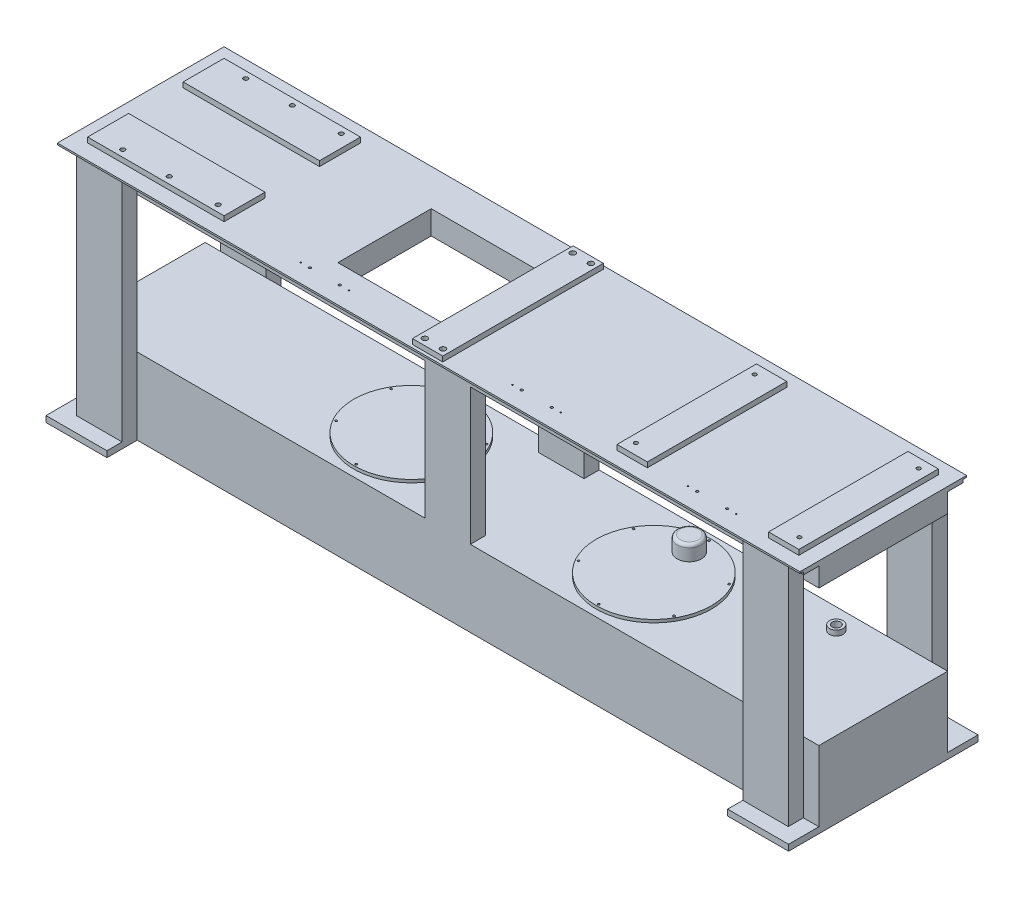
from build123d import *

# Parameters (mm, degrees)
SKETCH1_W                                 = 2450
SKETCH1_H                                 = 780
CORPO_DEPTH                               = 625
SKETCH3_W                                 = 2450
SKETCH3_H                                 = 754.4
CORTE_DOS_P_S_DEPTH                       = 50
SKETCH4_W                                 = 100
SKETCH4_H                                 = 745
CORTE_LATERAL_DEPTH                       = 51
ESPELHAMENTO_CORTE_LATERAL_2_COPY_1_SK_W  = 100
ESPELHAMENTO_CORTE_LATERAL_2_COPY_1_SK_H  = 745
ESPELHAMENTO_CORTE_LATERAL_2_COPY_1_DEPTH = 51
SKETCH5_W                                 = 425
SKETCH5_H                                 = 450
CORTE_INTERNO_DEPTH                       = 2559.36373489
SKETCH6_W                                 = 1024
SKETCH6_H                                 = 754.4
CORTE_DAS_PERNAS_DEPTH                    = 50
SKETCH7_W                                 = 150
SKETCH7_H                                 = 450
COLUNA_CENTRAL_DEPTH                      = 50
SKETCH8_W                                 = 100
SKETCH8_H                                 = 460
SKETCH8_H_2                               = 530
SKETCH8_W_2                               = 450
SKETCH8_H_3                               = 135
RESALTOS_DA_MESA_DEPTH                    = 17
RASGO_347X308_REACH                       = 1583.028
SKETCH9_W                                 = 347
SKETCH9_H                                 = 308
AJUSTE_TAMANHO_DA_MESA_REACH              = 1583.028
SKETCH16_W                                = 2450
SKETCH16_H                                = 37.5
SKETCH18_W                                = 2048
SKETCH18_H                                = 9.4
REBAIXO_DA_MESA_LADO_1_DEPTH              = 50
SKETCH38_W                                = 2048
SKETCH38_H                                = 9.4
REBAIXO_DA_MESA_LADO_2_DEPTH              = 50
SKETCH11_R                                = 4
FUROS_DOS_PINOS_8_DEPTH                   = 30
FUROS_DOS_CONTRAPONTOS_M5_D               = 4.2
FUROS_DOS_CONTRAPONTOS_M5_DEPTH           = 15
SKETCH17_W                                = 2048
SKETCH17_H                                = 100
CORTE_DO_CH_O_DEPTH                       = 1580.550252445
FUROS_PASSANTES_CENTRAIS_REACH            = 1591.484
SKETCH19_R                                = 8.9
FUROS_DA_MESA_M14_D                       = 12.5
FUROS_DA_MESA_M14_DEPTH                   = 95
FUROS_DA_MESA_M16_D                       = 14.5
FUROS_DA_MESA_M16_DEPTH                   = 95
SKETCH26_R                                = 22.5
ENCAIXE_DO_CANO_DA_BASE_DEPTH             = 17
FURO_DO_CANO_DA_BASE_M30_D                = 28
FURO_DO_CANO_DA_BASE_M30_DEPTH            = 30
FURO_DO_CANO_DA_BASE_M30_TIP              = 8.412048666
SKETCH29_R                                = 190
RESSALTOS_DA_BASE_DEPTH                   = 10
FUROS_DOS_RESSALTOS_M8_D                  = 7
FUROS_DOS_RESSALTOS_M8_DEPTH              = 30
FUROS_DOS_RESSALTOS_M8_TIP                = 2.103012167
SKETCH37_R                                = 40
TAMPA_DO_RESSALTO_DEPTH                   = 50
ARREDONDAMENTO_DA_TAMPA_R                 = 10


with BuildPart() as part:
    # Sketch1 → Corpo (new body)
    with BuildSketch(Plane.XY):
        Rectangle(SKETCH1_W, SKETCH1_H)
    extrude(amount=-CORPO_DEPTH)

    # Sketch3 → Corte dos Pés (cut)
    with BuildSketch(Plane.XY):
        with Locations((0, 7.2)):
            Rectangle(SKETCH3_W, SKETCH3_H)
    corte_dos_p_s = extrude(amount=-CORTE_DOS_P_S_DEPTH, mode=Mode.SUBTRACT)

    # Espelhamento - Corte dos Pés: Corte dos Pés across plane
    add(corte_dos_p_s.mirror(Plane.XY.offset(-312.5)), mode=Mode.SUBTRACT)

    # Sketch4 → Corte Lateral (cut)
    with BuildSketch(Plane(origin=(1225, 0, 0), x_dir=(0, 0, -1), z_dir=(1, 0, 0))):
        with Locations((50, 2.5)):
            Rectangle(SKETCH4_W, SKETCH4_H)
    corte_lateral = extrude(amount=-CORTE_LATERAL_DEPTH, mode=Mode.SUBTRACT)

    # Espelhamento - Corte Lateral 1: Corte Lateral across plane
    add(corte_lateral.mirror(Plane.XY.offset(-312.5)), mode=Mode.SUBTRACT)

    # Espelhamento - Corte Lateral 2: Corte Lateral across plane
    add(corte_lateral.mirror(Plane(origin=(0, 0, 0), x_dir=(0, 0, 1), z_dir=(1, 0, 0))), mode=Mode.SUBTRACT)

    # Espelhamento - Corte Lateral 2 copy 1 sk → Espelhamento - Corte Lateral 2 copy 1 (cut)
    with BuildSketch(Plane(origin=(-1225, 0, -625), x_dir=(0, 0, 1), z_dir=(-1, 0, 0))):
        with Locations((50, 2.5)):
            Rectangle(ESPELHAMENTO_CORTE_LATERAL_2_COPY_1_SK_W, ESPELHAMENTO_CORTE_LATERAL_2_COPY_1_SK_H)
    extrude(amount=-ESPELHAMENTO_CORTE_LATERAL_2_COPY_1_DEPTH, mode=Mode.SUBTRACT)

    # Sketch5 → Corte Interno (cut, through all)
    with BuildSketch(Plane(origin=(1225, 0, 0), x_dir=(0, 0, -1), z_dir=(1, 0, 0))):
        with Locations((312.5, 87)):
            Rectangle(SKETCH5_W, SKETCH5_H)
    extrude(amount=-CORTE_INTERNO_DEPTH, mode=Mode.SUBTRACT)

    # Sketch6 → Corte das Pernas (cut)
    with BuildSketch(Plane.XY.offset(-50)):
        with Locations((-512, 7.2)):
            Rectangle(SKETCH6_W, SKETCH6_H)
        with Locations((512, 7.2)):
            Rectangle(SKETCH6_W, SKETCH6_H)
    corte_das_pernas = extrude(amount=-CORTE_DAS_PERNAS_DEPTH, mode=Mode.SUBTRACT)

    # Espelhamento - Corte das Pernas: Corte das Pernas across plane
    add(corte_das_pernas.mirror(Plane.XY.offset(-312.5)), mode=Mode.SUBTRACT)

    # Sketch7 → Coluna Central (add)
    with BuildSketch(Plane.XY.offset(-100)):
        with Locations((0, 87)):
            Rectangle(SKETCH7_W, SKETCH7_H)
    coluna_central = extrude(amount=-COLUNA_CENTRAL_DEPTH)

    # Espelhamento - Coluna Central: Coluna Central across plane
    add(coluna_central.mirror(Plane.XY.offset(-312.5)))

    # Sketch8 → Resaltos da Mesa (add)
    with BuildSketch(Plane(origin=(0, 390, 0), x_dir=(1, 0, 0), z_dir=(0, 1, 0))):
        with Locations((1126.5, 312.5)):
            Rectangle(SKETCH8_W, SKETCH8_H)
        with Locations((626.5, 312.5)):
            Rectangle(SKETCH8_W, SKETCH8_H)
        with Locations((-13.5, 312.5)):
            Rectangle(SKETCH8_W, SKETCH8_H_2)
        with Locations((-950, 470)):
            Rectangle(SKETCH8_W_2, SKETCH8_H_3)
        with Locations((-950, 155)):
            Rectangle(SKETCH8_W_2, SKETCH8_H_3)
    extrude(amount=RESALTOS_DA_MESA_DEPTH)

    # Sketch9 → Rasgo 347x308 (cut, up to next)
    with BuildSketch(Plane(origin=(0, 390, 0), x_dir=(1, 0, 0), z_dir=(0, 1, 0)), mode=Mode.PRIVATE) as rasgo_347x308_sk1:
        with Locations((-247, 312.5)):
            Rectangle(SKETCH9_W, SKETCH9_H)
    rasgo_347x308_tool1 = extrude(rasgo_347x308_sk1.sketch, amount=-RASGO_347X308_REACH, mode=Mode.PRIVATE) & part.part
    add(rasgo_347x308_tool1.solids().sort_by_distance((-247, 390, -312.5))[0], mode=Mode.SUBTRACT)

    # Sketch16 → Ajuste - Tamanho da Mesa (cut, up to next)
    with BuildSketch(Plane(origin=(0, 390, 0), x_dir=(1, 0, 0), z_dir=(0, 1, 0)), mode=Mode.PRIVATE) as ajuste_tamanho_da_mesa_sk1:
        with Locations((0, 18.75)):
            Rectangle(SKETCH16_W, SKETCH16_H)
    ajuste_tamanho_da_mesa_tool1 = extrude(ajuste_tamanho_da_mesa_sk1.sketch, amount=-AJUSTE_TAMANHO_DA_MESA_REACH, mode=Mode.PRIVATE) & part.part
    # Sketch16 → Ajuste - Tamanho da Mesa (cut, up to next)
    with BuildSketch(Plane(origin=(0, 390, 0), x_dir=(1, 0, 0), z_dir=(0, 1, 0)), mode=Mode.PRIVATE) as ajuste_tamanho_da_mesa_sk2:
        with Locations((0, 606.25)):
            Rectangle(SKETCH16_W, SKETCH16_H)
    ajuste_tamanho_da_mesa_tool2 = extrude(ajuste_tamanho_da_mesa_sk2.sketch, amount=-AJUSTE_TAMANHO_DA_MESA_REACH, mode=Mode.PRIVATE) & part.part
    add(ajuste_tamanho_da_mesa_tool1.solids().sort_by_distance((0, 390, -18.75))[0], mode=Mode.SUBTRACT)
    add(ajuste_tamanho_da_mesa_tool2.solids().sort_by_distance((0, 390, -606.25))[0], mode=Mode.SUBTRACT)

    # Sketch18 → Rebaixo da Mesa - Lado 1 (add)
    with BuildSketch(Plane(origin=(0, 0, -525), x_dir=(-1, 0, 0), z_dir=(0, 0, -1))):
        with Locations((0, 379.7)):
            Rectangle(SKETCH18_W, SKETCH18_H)
    extrude(amount=REBAIXO_DA_MESA_LADO_1_DEPTH)

    # Sketch38 → Rebaixo da Mesa - Lado 2 (add)
    with BuildSketch(Plane.XY.offset(-100)):
        with Locations((0, 379.7)):
            Rectangle(SKETCH38_W, SKETCH38_H)
    extrude(amount=REBAIXO_DA_MESA_LADO_2_DEPTH)

    # Sketch11 → Furos dos Pinos - Ø8 (cut)
    with BuildSketch(Plane(origin=(0, 390, 0), x_dir=(1, 0, 0), z_dir=(0, 1, 0))):
        with Locations(Location((826, 97.5, 0), (0, 0, 270))):
            Circle(SKETCH11_R)
        with Locations(Location((925, 97.5, 0), (0, 0, 270))):
            Circle(SKETCH11_R)
        with Locations(Location((247, 97.5, 0), (0, 0, 141.317812547))):
            Circle(SKETCH11_R)
        with Locations(Location((346, 97.5, 0), (0, 0, 141.317812547))):
            Circle(SKETCH11_R)
        with Locations(Location((-452, 97.5, 0), (0, 0, 270))):
            Circle(SKETCH11_R)
        with Locations(Location((-353, 97.5, 0), (0, 0, 270))):
            Circle(SKETCH11_R)
    extrude(amount=-FUROS_DOS_PINOS_8_DEPTH, mode=Mode.SUBTRACT)

    # Furos dos Contrapontos - M5
    with Locations(Plane(origin=(0, 390, 0), x_dir=(1, 0, 0), z_dir=(0, 1, 0))):
        with Locations((955, 97.5), (796, 97.5), (376, 97.5), (217, 97.5), (-323, 97.5), (-482, 97.5)):
            Hole(FUROS_DOS_CONTRAPONTOS_M5_D / 2, depth=FUROS_DOS_CONTRAPONTOS_M5_DEPTH)

    # Sketch17 → Corte do chão (cut, through all)
    with BuildSketch(Plane(origin=(0, -370, 0), x_dir=(1, 0, 0), z_dir=(0, 1, 0))):
        with Locations((0, 50)):
            Rectangle(SKETCH17_W, SKETCH17_H)
    corte_do_ch_o = extrude(amount=-CORTE_DO_CH_O_DEPTH, mode=Mode.SUBTRACT)

    # Espelhamento - Corte do chão: Corte do chão across plane
    add(corte_do_ch_o.mirror(Plane.XY.offset(-312.5)), mode=Mode.SUBTRACT)

    # Sketch19 → Furos Passantes Centrais (cut, up to next)
    with BuildSketch(Plane(origin=(0, 407, 0), x_dir=(1, 0, 0), z_dir=(0, 1, 0)), mode=Mode.PRIVATE) as furos_passantes_centrais_sk1:
        with Locations(Location((-43.55, 556.6, 0), (0, 0, 270))):
            Circle(SKETCH19_R)
    furos_passantes_centrais_tool1 = extrude(furos_passantes_centrais_sk1.sketch, amount=-FUROS_PASSANTES_CENTRAIS_REACH, mode=Mode.PRIVATE) & part.part
    # Sketch19 → Furos Passantes Centrais (cut, up to next)
    with BuildSketch(Plane(origin=(0, 407, 0), x_dir=(1, 0, 0), z_dir=(0, 1, 0)), mode=Mode.PRIVATE) as furos_passantes_centrais_sk2:
        with Locations(Location((16.35, 556.6, 0), (0, 0, 270))):
            Circle(SKETCH19_R)
    furos_passantes_centrais_tool2 = extrude(furos_passantes_centrais_sk2.sketch, amount=-FUROS_PASSANTES_CENTRAIS_REACH, mode=Mode.PRIVATE) & part.part
    # Sketch19 → Furos Passantes Centrais (cut, up to next)
    with BuildSketch(Plane(origin=(0, 407, 0), x_dir=(1, 0, 0), z_dir=(0, 1, 0)), mode=Mode.PRIVATE) as furos_passantes_centrais_sk3:
        with Locations(Location((-43.55, 68.4, 0), (0, 0, 270))):
            Circle(SKETCH19_R)
    furos_passantes_centrais_tool3 = extrude(furos_passantes_centrais_sk3.sketch, amount=-FUROS_PASSANTES_CENTRAIS_REACH, mode=Mode.PRIVATE) & part.part
    # Sketch19 → Furos Passantes Centrais (cut, up to next)
    with BuildSketch(Plane(origin=(0, 407, 0), x_dir=(1, 0, 0), z_dir=(0, 1, 0)), mode=Mode.PRIVATE) as furos_passantes_centrais_sk4:
        with Locations(Location((16.35, 68.4, 0), (0, 0, 270))):
            Circle(SKETCH19_R)
    furos_passantes_centrais_tool4 = extrude(furos_passantes_centrais_sk4.sketch, amount=-FUROS_PASSANTES_CENTRAIS_REACH, mode=Mode.PRIVATE) & part.part
    add(furos_passantes_centrais_tool1.solids().sort_by_distance((-43.55, 407, -556.6))[0], mode=Mode.SUBTRACT)
    add(furos_passantes_centrais_tool2.solids().sort_by_distance((16.35, 407, -556.6))[0], mode=Mode.SUBTRACT)
    add(furos_passantes_centrais_tool3.solids().sort_by_distance((-43.55, 407, -68.4))[0], mode=Mode.SUBTRACT)
    add(furos_passantes_centrais_tool4.solids().sort_by_distance((16.35, 407, -68.4))[0], mode=Mode.SUBTRACT)

    # Furos da Mesa - M14
    with Locations(Plane(origin=(0, 407, 0), x_dir=(1, 0, 0), z_dir=(0, 1, 0))):
        with Locations((1142.5, 118), (1142.5, 511.5), (603.5, 509.5), (603.5, 118)):
            Hole(FUROS_DA_MESA_M14_D / 2, depth=FUROS_DA_MESA_M14_DEPTH)

    # Furos da Mesa - M16
    with Locations(Plane(origin=(0, 407, 0), x_dir=(1, 0, 0), z_dir=(0, 1, 0))):
        with Locations((-766.4, 515.5), (-927.9, 515.5), (-1081.4, 515.5), (-1081.4, 109.5), (-927.9, 109.5), (-766.4, 109.5)):
            Hole(FUROS_DA_MESA_M16_D / 2, depth=FUROS_DA_MESA_M16_DEPTH)

    # Sketch26 → Encaixe do Cano da Base (add)
    with BuildSketch(Plane(origin=(0, -138, 0), x_dir=(1, 0, 0), z_dir=(0, 1, 0))):
        with Locations(Location((925, 457.5, 0), (0, 0, 90))):
            Circle(SKETCH26_R)
    extrude(amount=ENCAIXE_DO_CANO_DA_BASE_DEPTH)

    # Furo do Cano da Base - M30
    with Locations(Plane(origin=(0, -121, 0), x_dir=(1, 0, 0), z_dir=(0, 1, 0))):
        with Locations((925, 457.5)):
            Hole(FURO_DO_CANO_DA_BASE_M30_D / 2, depth=FURO_DO_CANO_DA_BASE_M30_DEPTH)
            with Locations((0, 0, -(FURO_DO_CANO_DA_BASE_M30_DEPTH + FURO_DO_CANO_DA_BASE_M30_TIP / 2))):  # 118° drill point
                Cone(0, FURO_DO_CANO_DA_BASE_M30_D / 2, FURO_DO_CANO_DA_BASE_M30_TIP, mode=Mode.SUBTRACT)

    # Sketch29 → Ressaltos da Base (add)
    with BuildSketch(Plane(origin=(0, -138, 0), x_dir=(1, 0, 0), z_dir=(0, 1, 0))):
        with Locations(Location((468, 312.5, 0), (0, 0, 90))):
            Circle(SKETCH29_R)
        with Locations(Location((-332, 312.5, 0), (0, 0, 90))):
            Circle(SKETCH29_R)
    extrude(amount=RESSALTOS_DA_BASE_DEPTH)

    # Furos dos Ressaltos - M8
    with Locations(Plane(origin=(0, -128, 0), x_dir=(1, 0, 0), z_dir=(0, 1, 0))):
        with Locations((468, 494.5), (625.616623489, 403.5), (625.616623489, 221.5), (468, 130.5), (310.383376511, 221.5), (310.383376511, 403.5), (-332, 494.5), (-174.383376511, 403.5), (-174.383376511, 221.5), (-332, 130.5), (-489.616623489, 221.5), (-489.616623489, 403.5)):
            Hole(FUROS_DOS_RESSALTOS_M8_D / 2, depth=FUROS_DOS_RESSALTOS_M8_DEPTH)
            with Locations((0, 0, -(FUROS_DOS_RESSALTOS_M8_DEPTH + FUROS_DOS_RESSALTOS_M8_TIP / 2))):  # 118° drill point
                Cone(0, FUROS_DOS_RESSALTOS_M8_D / 2, FUROS_DOS_RESSALTOS_M8_TIP, mode=Mode.SUBTRACT)

    # Sketch37 → Tampa do Ressalto (add)
    with BuildSketch(Plane(origin=(0, -128, 0), x_dir=(1, 0, 0), z_dir=(0, 1, 0))):
        with Locations(Location((468, 429.5, 0), (0, 0, 270))):
            Circle(SKETCH37_R)
    extrude(amount=TAMPA_DO_RESSALTO_DEPTH)

    # Arredondamento da Tampa
    arredondamento_da_tampa_edges = [part.edges().sort_by_distance(p)[0] for p in [
        (468, -78, -469.5),
    ]]
    fillet(arredondamento_da_tampa_edges, radius=ARREDONDAMENTO_DA_TAMPA_R)


solid = part.part
